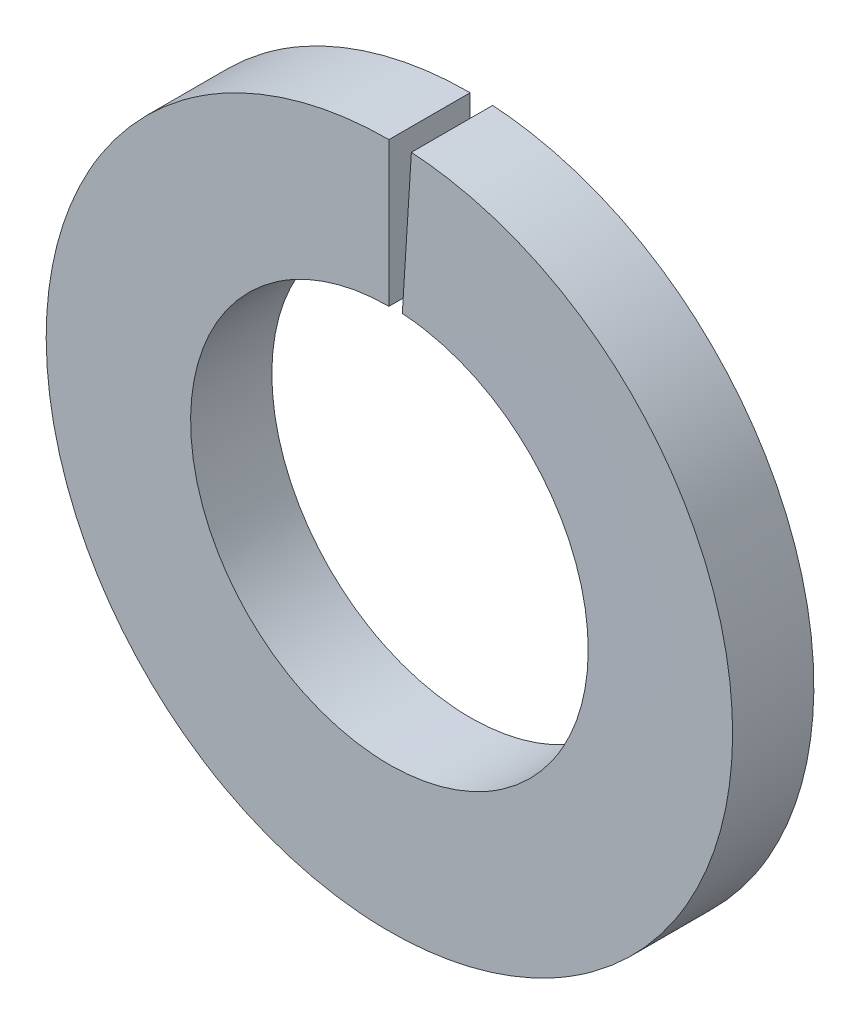
from build123d import *

# Parameters (mm, degrees)
SWEEP1_PITCH       = 0.01010101
SWEEP1_HEIGHT      = 0.01
SWEEP1_RADIUS      = 3.8
SWEEP1_START_ANGLE = 90
SKETCH4_W          = 0.9
SKETCH4_H          = 1.6


with BuildPart() as part:
    # Sweep1: sweep along a helix
    with BuildLine() as sweep1_path:
        add(Helix(SWEEP1_PITCH, SWEEP1_HEIGHT, SWEEP1_RADIUS, center=(0, 0, 0), direction=(0, 0, -1), lefthand=True, mode=Mode.PRIVATE).rotate(Axis((0, 0, 0), (0, 0, -1)), SWEEP1_START_ANGLE))
    # Sketch4 → Sweep1 (sweep)
    with BuildSketch(Plane(origin=(0, 0, 0), x_dir=(0, 0, -1), z_dir=(1, 0, 0))):
        with Locations((-0.45, 3)):
            Rectangle(SKETCH4_W, SKETCH4_H)
    sweep(path=sweep1_path.line, is_frenet=True)


solid = part.part
